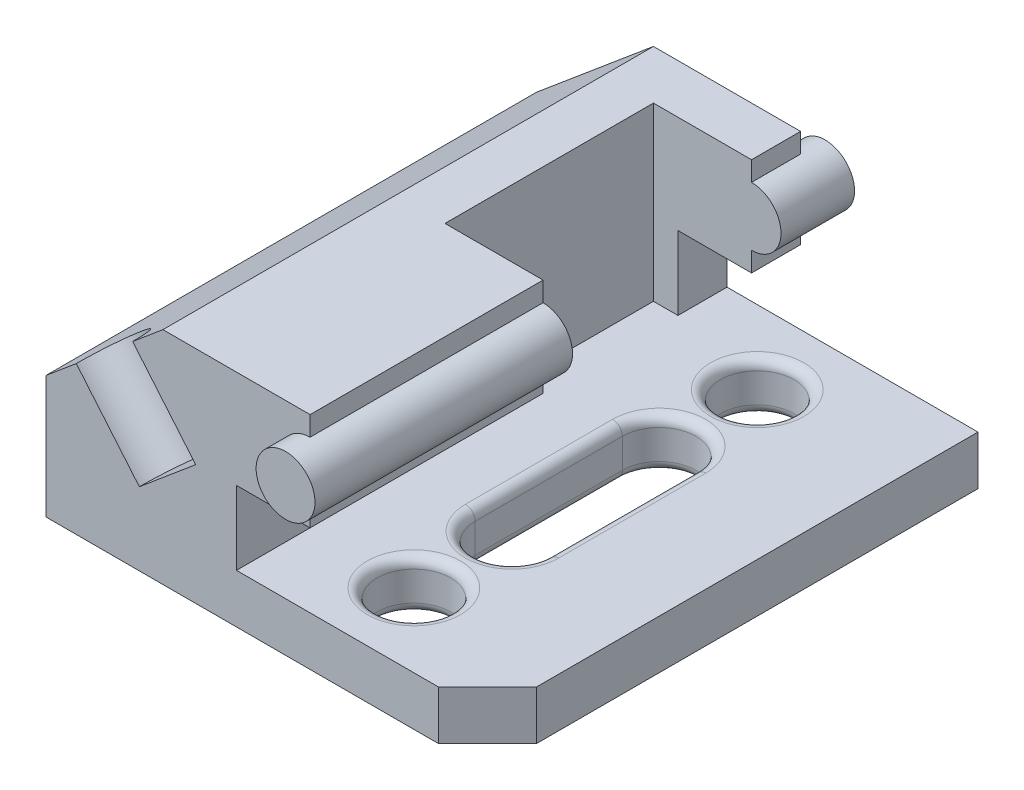
from build123d import *

# Parameters (mm, degrees)
BOSS_EXTRUDE1_DEPTH      = 10
SKETCH2_R                = 7.5
CUT_EXTRUDE1_DEPTH       = 135.907375632
FILLET1_R                = 2
BOSS_EXTRUDE2_DEPTH      = 100
BOSS_EXTRUDE3_DEPTH      = 5
BOSS_EXTRUDE3_DEPTH_BACK = 105
SKETCH4_R                = 6
CUT_EXTRUDE2_DEPTH       = 146.430395722
CUT_EXTRUDE2_DEPTH_BACK  = 35
SKETCH5_W                = 26
SKETCH5_H                = 42.5
SKETCH6_R                = 7.5
CUT_EXTRUDE3_DEPTH       = 20


with BuildPart() as part:
    # Sketch1 → Boss-Extrude1 (new body)
    with BuildSketch(Plane(origin=(0, 0, 0), x_dir=(1, 0, 0), z_dir=(0, 1, 0))):
        Polygon((-90, -100), (-10, -100), (0, -90), (0, 0), (-90, 0), align=None)
    extrude(amount=-BOSS_EXTRUDE1_DEPTH)

    # Sketch2 → Cut-Extrude1 (cut, through all)
    with BuildSketch(Plane(origin=(0, 0, 0), x_dir=(1, 0, 0), z_dir=(0, 1, 0))):
        with Locations(Location((-30, -15, 0), (0, 0, 270))):
            Circle(SKETCH2_R)
        with Locations(Location((-30, -85, 0), (0, 0, 270))):
            Circle(SKETCH2_R)
        with BuildLine():
            Line((-37.5, -65), (-37.5, -35))
            ThreePointArc((-37.5, -35), (-30, -27.5), (-22.5, -35))
            Line((-22.5, -35), (-22.5, -65))
            ThreePointArc((-22.5, -65), (-30, -72.5), (-37.5, -65))
        make_face()
    extrude(amount=-CUT_EXTRUDE1_DEPTH, mode=Mode.SUBTRACT)

    # Fillet1
    fillet1_edges = [part.edges().sort_by_distance(p)[0] for p in [
        (-30, -10, 7.5),
        (-30, 0, 7.5),
        (-30, -10, 77.5),
        (-30, 0, 77.5),
        (-30, -10, 72.5),
        (-37.5, -10, 50),
        (-30, -10, 27.5),
        (-22.5, -10, 50),
        (-30, 0, 72.5),
        (-22.5, 0, 50),
        (-30, 0, 27.5),
        (-37.5, 0, 50),
    ]]
    fillet(fillet1_edges, radius=FILLET1_R)

    # Sketch3 → Boss-Extrude2 (add, through all)
    with BuildSketch(Plane.XY.offset(100)):
        Polygon((-90, -10), (-90, 15), (-66.164928148, 35), (-36.164928148, 35), (-36.164928148, 15), (-51.164928148, 15), (-51.164928148, -10), align=None)
    extrude(amount=-BOSS_EXTRUDE2_DEPTH)

    # Sketch4 → Boss-Extrude3 (add, two sides: drawn at the far end of the back side and taken through both)
    with BuildSketch(Plane.XY.offset(100).offset(-BOSS_EXTRUDE3_DEPTH_BACK)):
        with Locations((-36.164928148, 25)):
            Circle(SKETCH4_R)
    extrude(amount=BOSS_EXTRUDE3_DEPTH + BOSS_EXTRUDE3_DEPTH_BACK)

    # Sketch5 → Cut-Extrude2 (cut, two sides: drawn at the far end of the back side and taken through both)
    with BuildSketch(Plane(origin=(0, 35, 0), x_dir=(1, 0, 0), z_dir=(0, 1, 0)).offset(-CUT_EXTRUDE2_DEPTH_BACK)):
        with Locations((-43.164928148, -31.25)):
            Rectangle(SKETCH5_W, SKETCH5_H)
    extrude(amount=CUT_EXTRUDE2_DEPTH + CUT_EXTRUDE2_DEPTH_BACK, mode=Mode.SUBTRACT)

    # Sketch6 → Cut-Extrude3 (cut)
    with BuildSketch(Plane(origin=(-44.571890153, 53.118710218, 0), x_dir=(0.7660444431189795, 0.6427876096865378, 0), z_dir=(-0.6427876096865378, 0.7660444431189795, 0))):
        with Locations((-43.744947467, -100)):
            Circle(SKETCH6_R)
    extrude(amount=-CUT_EXTRUDE3_DEPTH, mode=Mode.SUBTRACT)


solid = part.part
